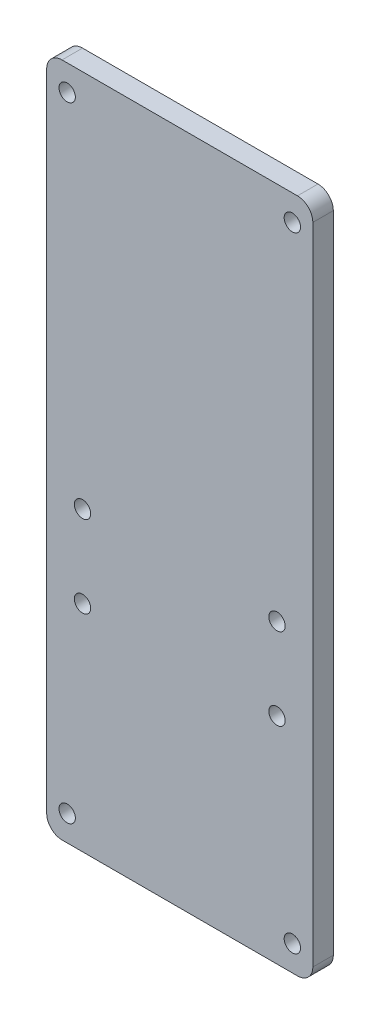
from build123d import *

# Parameters (mm, degrees)
SKETCH1_R           = 1.6
BOSS_EXTRUDE1_DEPTH = 4


with BuildPart() as part:
    # Sketch1 → Boss-Extrude1 (new body)
    with BuildSketch(Plane.XY):
        with BuildLine():
            Line((23.206941284, 124.936391703), (23.206941284, -1.063608297))
            ThreePointArc((23.206941284, -1.063608297), (24.085620941, -3.184928641), (26.206941284, -4.063608297))
            Line((26.206941284, -4.063608297), (72.208519176, -4.063608297))
            ThreePointArc((72.208519176, -4.063608297), (74.32983952, -3.184928641), (75.208519176, -1.063608297))
            Line((75.208519176, -1.063608297), (75.208519176, 124.936391703))
            ThreePointArc((75.208519176, 124.936391703), (74.32983952, 127.057712046), (72.208519176, 127.936391703))
            Line((72.208519176, 127.936391703), (26.206941284, 127.936391703))
            ThreePointArc((26.206941284, 127.936391703), (24.085620941, 127.057712046), (23.206941284, 124.936391703))
        make_face()
        with Locations((30.20773023, 53.936391703)):
            Circle(SKETCH1_R, mode=Mode.SUBTRACT)
        with Locations((27.206941284, 0.936391703)):
            Circle(SKETCH1_R, mode=Mode.SUBTRACT)
        with Locations((30.20773023, 37.936391703)):
            Circle(SKETCH1_R, mode=Mode.SUBTRACT)
        with Locations((71.208519176, 122.936391703)):
            Circle(SKETCH1_R, mode=Mode.SUBTRACT)
        with Locations(Location((71.208519176, 0.936391703, 0), (0, 0, 180))):
            Circle(SKETCH1_R, mode=Mode.SUBTRACT)
        with Locations(Location((68.20773023, 53.936391703, 0), (0, 0, 180))):
            Circle(SKETCH1_R, mode=Mode.SUBTRACT)
        with Locations(Location((27.206941284, 122.936391703, 0), (0, 0, 180))):
            Circle(SKETCH1_R, mode=Mode.SUBTRACT)
        with Locations((68.20773023, 37.936391703)):
            Circle(SKETCH1_R, mode=Mode.SUBTRACT)
    extrude(amount=BOSS_EXTRUDE1_DEPTH)


solid = part.part
